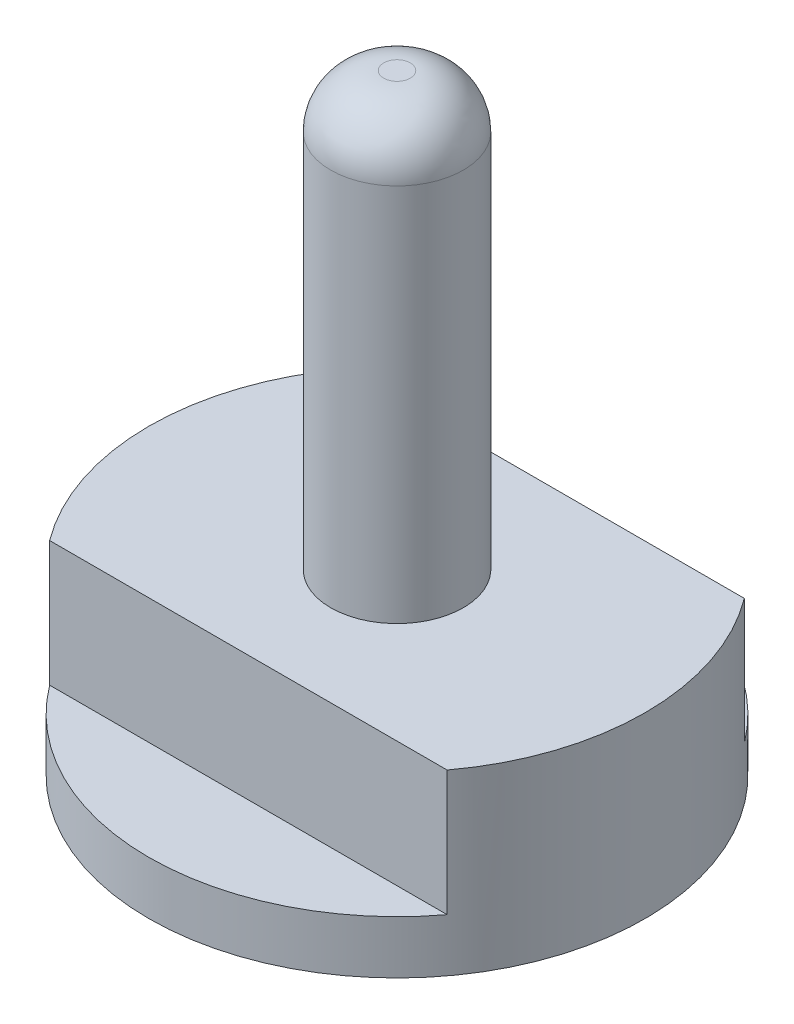
from build123d import *

# Parameters (mm, degrees)
BASE_EXTRUDE_DEPTH  = 3.36
SKETCH3_R           = 1.25
BOSS_EXTRUDE1_DEPTH = 8.14
FILLET1_R           = 1
BOSS_EXTRUDE2_START = -1
SKETCH4_R           = 4.675
BOSS_EXTRUDE2_DEPTH = 1
SKETCH5_R           = 1.675
SKETCH5_R_2         = 1.175
BOSS_EXTRUDE3_DEPTH = 2


with BuildPart() as part:
    # Sketch2 → Base-Extrude (new body)
    with BuildSketch(Plane(origin=(0, 3.36, 0), x_dir=(-1, 0, 0), z_dir=(0, 1, 0))):
        with BuildLine():
            Line((-3.743744783, 0), (3.743744783, 0))
            ThreePointArc((3.743744783, 0), (4.675, 2.8), (3.743744783, 5.6))
            Line((3.743744783, 5.6), (-3.743744783, 5.6))
            ThreePointArc((-3.743744783, 5.6), (-4.675, 2.8), (-3.743744783, 0))
        make_face()
    extrude(amount=-BASE_EXTRUDE_DEPTH)

    # Sketch3 → Boss-Extrude1 (add)
    with BuildSketch(Plane(origin=(0, 3.36, 0), x_dir=(-1, 0, 0), z_dir=(0, 1, 0))):
        with Locations(Location((0, 2.8, 0), (0, 0, 90))):
            Circle(SKETCH3_R)
    extrude(amount=BOSS_EXTRUDE1_DEPTH)

    # Fillet1
    fillet1_edges = [part.edges().sort_by_distance(p)[0] for p in [
        (0, 11.5, 1.55),
    ]]
    fillet(fillet1_edges, radius=FILLET1_R)

    # Sketch4 → Boss-Extrude2 (add)
    with BuildSketch(Plane.XZ.offset(BOSS_EXTRUDE2_START)):
        with Locations(Location((0, 2.8, 0), (0, 0, 90))):
            Circle(SKETCH4_R)
    extrude(amount=BOSS_EXTRUDE2_DEPTH)

    # Sketch5 → Boss-Extrude3 (add)
    with BuildSketch(Plane.XZ):
        with Locations(Location((0, 2.8, 0), (0, 0, 90))):
            Circle(SKETCH5_R)
        with Locations(Location((0, 2.8, 0), (0, 0, 270))):
            Circle(SKETCH5_R_2, mode=Mode.SUBTRACT)
    extrude(amount=BOSS_EXTRUDE3_DEPTH)


solid = part.part
